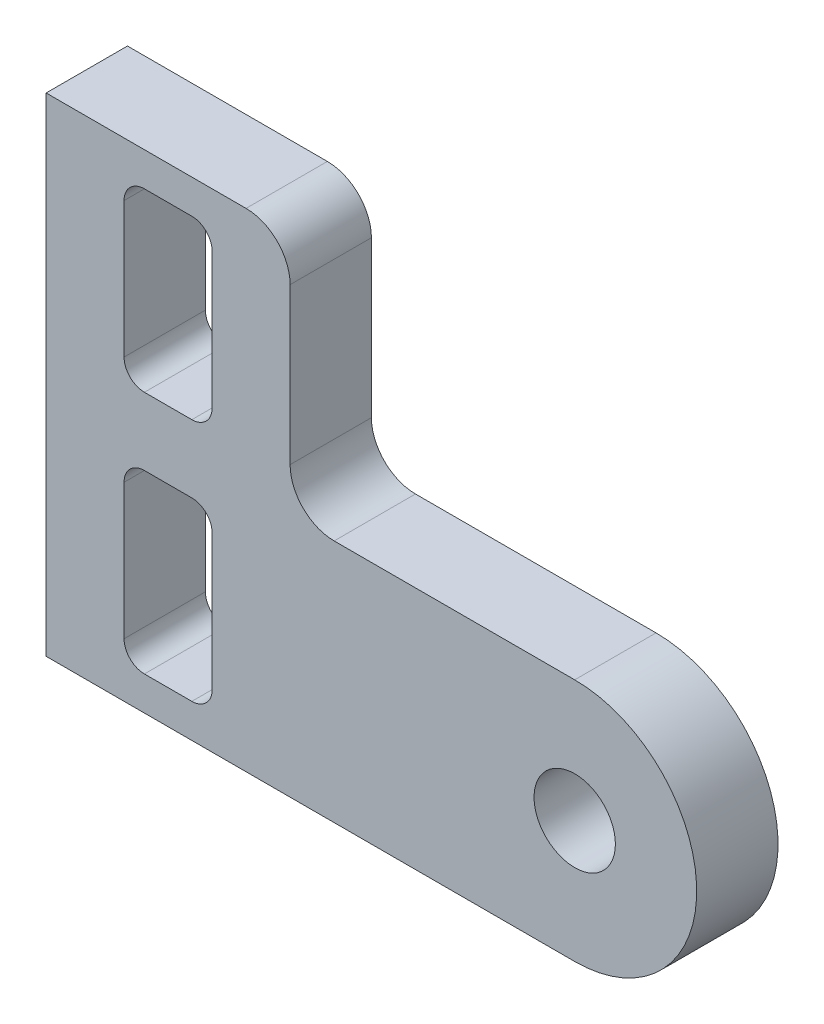
from build123d import *

# Parameters (mm, degrees)
MODEL_R                 = 1.5
SALIENTE_EXTRUIR1_DEPTH = 3


with BuildPart() as part:
    # Model → Saliente-Extruir1 (new body)
    with BuildSketch(Plane.XY):
        with BuildLine():
            Line((201.097853309, 264.646547335), (181.597853309, 264.646547335))
            Line((181.597853309, 264.646547335), (181.597853309, 282.646547335))
            Line((181.597853309, 282.646547335), (188.972853309, 282.646547335))
            ThreePointArc((188.972853309, 282.646547335), (190.121901829, 282.170595855), (190.597853309, 281.021547335))
            Line((190.597853309, 281.021547335), (190.597853309, 275.271547335))
            ThreePointArc((190.597853309, 275.271547335), (191.07380479, 274.122498816), (192.222853309, 273.646547335))
            Line((192.222853309, 273.646547335), (201.097853309, 273.646547335))
            ThreePointArc((201.097853309, 273.646547335), (205.597853309, 269.146547335), (201.097853309, 264.646547335))
        make_face()
        with Locations((201.097853309, 269.146547335)):
            Circle(MODEL_R, mode=Mode.SUBTRACT)
        with BuildLine():
            Line((185.222853309, 265.896547335), (186.972853309, 265.896547335))
            ThreePointArc((186.972853309, 265.896547335), (187.503183395, 266.116217249), (187.722853309, 266.646547335))
            Line((187.722853309, 266.646547335), (187.722853309, 271.646547335))
            ThreePointArc((187.722853309, 271.646547335), (187.503183395, 272.176877421), (186.972853309, 272.396547335))
            Line((186.972853309, 272.396547335), (185.222853309, 272.396547335))
            ThreePointArc((185.222853309, 272.396547335), (184.692523223, 272.176877421), (184.472853309, 271.646547335))
            Line((184.472853309, 271.646547335), (184.472853309, 266.646547335))
            ThreePointArc((184.472853309, 266.646547335), (184.692523223, 266.116217249), (185.222853309, 265.896547335))
        make_face(mode=Mode.SUBTRACT)
        with BuildLine():
            Line((185.222853309, 274.895968764), (186.972853309, 274.895968764))
            ThreePointArc((186.972853309, 274.895968764), (187.503183395, 275.115638678), (187.722853309, 275.645968764))
            Line((187.722853309, 275.645968764), (187.722853309, 280.645968764))
            ThreePointArc((187.722853309, 280.645968764), (187.503183395, 281.17629885), (186.972853309, 281.395968764))
            Line((186.972853309, 281.395968764), (185.222853309, 281.395968764))
            ThreePointArc((185.222853309, 281.395968764), (184.692523223, 281.17629885), (184.472853309, 280.645968764))
            Line((184.472853309, 280.645968764), (184.472853309, 275.645968764))
            ThreePointArc((184.472853309, 275.645968764), (184.692523223, 275.115638678), (185.222853309, 274.895968764))
        make_face(mode=Mode.SUBTRACT)
    extrude(amount=SALIENTE_EXTRUIR1_DEPTH)


solid = part.part
